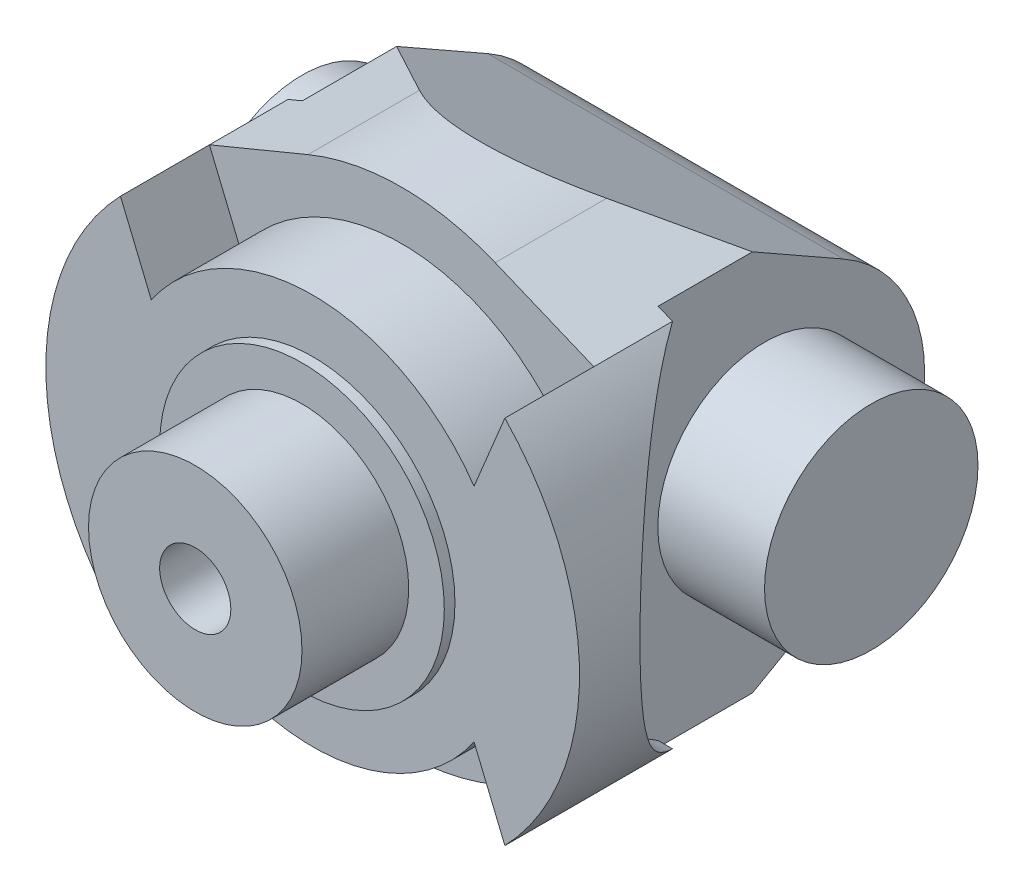
from build123d import *
from build123d.topology import SkipClean

# Parameters (mm, degrees)
SKETCH1_R                = 6
BOSS_EXTRUDE1_DEPTH      = 11
SKETCH2_R                = 6
BOSS_EXTRUDE2_DEPTH      = 8
CUT_EXTRUDE1_DEPTH       = 10
CUT_EXTRUDE1_DEPTH_BACK  = 3
SKETCH3_R                = 6
SKETCH3_R_2              = 3
SKETCH5_W                = 8.868099488
SKETCH5_H                = 25.092164851
CUT_EXTRUDE3_DEPTH       = 20.723082923
CUT_EXTRUDE2_START       = -3.3
CUT_EXTRUDE2_DEPTH       = 3.3
CUT_EXTRUDE5_DEPTH       = 2.5
BOSS_EXTRUDE3_REACH      = 18.961
BOSS_EXTRUDE3_END_RADIUS = 6
BOSS_EXTRUDE4_START      = -2.211146
BOSS_EXTRUDE4_DEPTH      = 2.211146
SKETCH10_R               = 3
CUT_EXTRUDE6_DEPTH       = 19.364367672
SKETCH12_R               = 4
SKETCH12_R_2             = 3
BOSS_EXTRUDE5_DEPTH      = 0.3
BOSS_EXTRUDE6_START      = -5
BOSS_EXTRUDE6_DEPTH      = 10
CUT_EXTRUDE12_DEPTH      = 19.364367672
CUT_EXTRUDE9_DEPTH       = 14.244940814
SKETCH15_OUTSIDE_W       = 23.236
SKETCH15_OUTSIDE_H       = 20.984
SKETCH15_OUTSIDE_W_2     = 17.302035992
SKETCH15_OUTSIDE_H_2     = 16.797371099
CUT_EXTRUDE10_DEPTH      = 19.748333259
SKETCH16_R               = 1
CUT_EXTRUDE11_DEPTH      = 19.748333259


with BuildPart() as part:
    # Sketch1 → Boss-Extrude1 (new body)
    with BuildSketch(Plane.XY):
        Circle(SKETCH1_R)
    extrude(amount=BOSS_EXTRUDE1_DEPTH)

    # Sketch2 → Boss-Extrude2 (add, symmetric)
    with BuildSketch(Plane(origin=(0, 0, 0), x_dir=(0, 0, -1), z_dir=(1, 0, 0))):
        Circle(SKETCH2_R)
    extrude(amount=BOSS_EXTRUDE2_DEPTH, both=True)

    # Sketch3 → Cut-Extrude1 (cut, two sides: drawn at the far end of the back side and taken through both)
    with BuildSketch(Plane.ZY.offset(8).offset(-CUT_EXTRUDE1_DEPTH_BACK)):
        with Locations(Location((0, 0, 0), (0, 0, 33.557309762))):
            Circle(SKETCH3_R)
        with Locations(Location((0, 0, 0), (0, 0, 180))):
            Circle(SKETCH3_R_2, mode=Mode.SUBTRACT)
    extrude(amount=CUT_EXTRUDE1_DEPTH + CUT_EXTRUDE1_DEPTH_BACK, mode=Mode.SUBTRACT)

    # Sketch5 → Cut-Extrude3 (cut, through all)
    with BuildSketch(Plane.XY.offset(11)):
        with Locations((4.434049744, 3.885168382)):
            Rectangle(SKETCH5_W, SKETCH5_H)
    extrude(amount=-CUT_EXTRUDE3_DEPTH, mode=Mode.SUBTRACT)

    # Sketch4 → Cut-Extrude2 (cut)
    with BuildSketch(Plane.XY.offset(11).offset(CUT_EXTRUDE2_START)):
        with BuildLine():
            Line((0, 3), (0, 6))
            ThreePointArc((0, 6), (-6, 0), (0, -6))
            Line((0, -6), (0, -3))
            ThreePointArc((0, -3), (-3, 0), (0, 3))
        make_face()
    extrude(amount=CUT_EXTRUDE2_DEPTH, mode=Mode.SUBTRACT)

    # Mirror1: part across plane


with BuildPart() as part_1:
    with SkipClean():  # the faces are left unmerged after this step: merging them gives an invalid solid
        add(part.part)
        add(part.part.mirror(Plane(origin=(0, -8.660914044, -6), x_dir=(0, 0, 1), z_dir=(-1, 0, 0))))

    # Sketch7 → Cut-Extrude5 (cut)
    with BuildSketch(Plane.XY.offset(7.7)):
        with BuildLine():
            Line((-4.535722056, 3.110823914), (-5.732457975, 6))
            Line((-5.732457975, 6), (5.732457975, 6))
            Line((5.732457975, 6), (4.535722056, 3.110823914))
            ThreePointArc((4.535722056, 3.110823914), (0, 5.5), (-4.535722056, 3.110823914))
        make_face()
        with BuildLine():
            Line((4.535722056, -3.110823914), (5.732457975, -6))
            Line((5.732457975, -6), (-5.732457975, -6))
            Line((-5.732457975, -6), (-4.535722056, -3.110823914))
            ThreePointArc((-4.535722056, -3.110823914), (0, -5.5), (4.535722056, -3.110823914))
        make_face()
    extrude(amount=-CUT_EXTRUDE5_DEPTH, mode=Mode.SUBTRACT)

    # Boss-Extrude3: up to this cylinder (the profile starts outside it)
    with SkipClean():  # the faces are left unmerged after this step: merging them gives an invalid solid
        boss_extrude3_end = Plane(origin=(0, 0, 0), z_dir=(1, 0, 0)) * Cylinder(BOSS_EXTRUDE3_END_RADIUS, 63.367438, mode=Mode.PRIVATE)
        # Sketch8 → Boss-Extrude3 (add, up to the surface)
        with BuildSketch(Plane.XY.offset(7.7), mode=Mode.PRIVATE) as boss_extrude3_sk1:
            with BuildLine():
                Line((4.760120042, 3.652568574), (5.402152292, 5.202571539))
                ThreePointArc((5.402152292, 5.202571539), (7.5, 0), (5.402152292, -5.202571539))
                Line((5.402152292, -5.202571539), (4.760120042, -3.652568574))
                ThreePointArc((4.760120042, -3.652568574), (6, 0), (4.760120042, 3.652568574))
            make_face()
        boss_extrude3_tool1 = extrude(boss_extrude3_sk1.sketch, amount=-BOSS_EXTRUDE3_REACH, mode=Mode.PRIVATE) - boss_extrude3_end
        add(boss_extrude3_tool1.solids().sort_by_distance((6.222719, 0, 7.7))[0])
        # Sketch8 → Boss-Extrude3 (add, up to the surface)
        with BuildSketch(Plane.XY.offset(7.7), mode=Mode.PRIVATE) as boss_extrude3_sk2:
            with BuildLine():
                Line((-4.760120042, 3.652568574), (-5.402152292, 5.202571539))
                ThreePointArc((-5.402152292, 5.202571539), (-7.5, 0), (-5.402152292, -5.202571539))
                Line((-5.402152292, -5.202571539), (-4.760120042, -3.652568574))
                ThreePointArc((-4.760120042, -3.652568574), (-6, 0), (-4.760120042, 3.652568574))
            make_face()
        boss_extrude3_tool2 = extrude(boss_extrude3_sk2.sketch, amount=-BOSS_EXTRUDE3_REACH, mode=Mode.PRIVATE) - boss_extrude3_end
        add(boss_extrude3_tool2.solids().sort_by_distance((-6.222719, 0, 7.7))[0])

    # Sketch9 → Boss-Extrude4 (add)
    with SkipClean():  # the faces are left unmerged after this step: merging them gives an invalid solid
        with BuildSketch(Plane.XY.offset(5.2).offset(BOSS_EXTRUDE4_START)):
            with BuildLine():
                Line((2.630513694, 6.350621836), (5.402152292, 5.202571539))
                Line((5.402152292, 5.202571539), (4.760120042, 3.652568574))
                ThreePointArc((4.760120042, 3.652568574), (0, 6), (-4.760120042, 3.652568574))
                Line((-4.760120042, 3.652568574), (-5.402152292, 5.202571539))
                Line((-5.402152292, 5.202571539), (-2.630513694, 6.350621836))
                ThreePointArc((-2.630513694, 6.350621836), (0, 6.873863542), (2.630513694, 6.350621836))
            make_face()
        extrude(amount=BOSS_EXTRUDE4_DEPTH)

    # Sketch10 → Cut-Extrude6 (cut, through all)
    with SkipClean():  # the faces are left unmerged after this step: merging them gives an invalid solid
        with BuildSketch(Plane.ZY.offset(5)):
            with BuildLine():
                ThreePointArc((2.988854192, 5.202571539), (-5.94680377, -0.79719817), (4.25356316, -4.231690023))
                ThreePointArc((4.25356316, -4.231690023), (5.94680377, 0.79719817), (2.988854192, 5.202571539))
            make_face()
            with Locations(Location((0, 0, 0), (0, 0, 180))):
                Circle(SKETCH10_R, mode=Mode.SUBTRACT)
        extrude(amount=CUT_EXTRUDE6_DEPTH, mode=Mode.SUBTRACT)

    # Mirror2: part across plane


with BuildPart() as part_2:
    add(part_1.part)
    add(part_1.part.mirror(Plane.ZX))

    # Sketch12 → Boss-Extrude5 (add)
    with BuildSketch(Plane.XY.offset(7.7)):
        Circle(SKETCH12_R)
        Circle(SKETCH12_R_2, mode=Mode.SUBTRACT)
    extrude(amount=BOSS_EXTRUDE5_DEPTH)

    # Sketch13 → Boss-Extrude6 (add)
    with BuildSketch(Plane(origin=(0, 0, 0), x_dir=(0, 0, -1), z_dir=(1, 0, 0)).offset(BOSS_EXTRUDE6_START)):
        with BuildLine():
            Line((-2.988854192, -6.873863542), (-2.988854192, -5.202571539))
            ThreePointArc((-2.988854192, -5.202571539), (-0.863689726, -5.937511268), (1.38278621, -5.838484589))
            Line((1.38278621, -5.838484589), (-2.988854192, -6.873863542))
        make_face()
        with BuildLine():
            Line((-2.988854192, 5.202571539), (-2.988854192, 6.873863542))
            Line((-2.988854192, 6.873863542), (1.38278621, 5.838484589))
            ThreePointArc((1.38278621, 5.838484589), (-0.863689726, 5.937511268), (-2.988854192, 5.202571539))
        make_face()
    extrude(amount=BOSS_EXTRUDE6_DEPTH)

    # Sketch17 → Cut-Extrude12 (cut, through all)
    with BuildSketch(Plane.ZY.offset(5)):
        with BuildLine():
            Line((2.988854192, -6.873863542), (-2.223044712, -3.912553157))
            ThreePointArc((-2.223044712, -3.912553157), (-4.5, 0), (-2.223044712, 3.912553157))
            Line((-2.223044712, 3.912553157), (2.988854192, 6.873863542))
            Line((2.988854192, 6.873863542), (-1.38278621, 5.838484589))
            ThreePointArc((-1.38278621, 5.838484589), (-6, 0), (-1.38278621, -5.838484589))
            Line((-1.38278621, -5.838484589), (2.988854192, -6.873863542))
        make_face()
    extrude(amount=-CUT_EXTRUDE12_DEPTH, mode=Mode.SUBTRACT)

    # Sketch14 → Cut-Extrude9 (cut, through all)
    with BuildSketch(Plane(origin=(0, 0, 2.988854192), x_dir=(-1, 0, 0), z_dir=(0, 0, -1))):
        with BuildLine():
            Line((5, -16.873863542), (-5, -16.873863542))
            Line((-5, -16.873863542), (-5, -5.369148472))
            Line((-5, -5.369148472), (-2.630513694, -6.350621836))
            ThreePointArc((-2.630513694, -6.350621836), (-1.341024252, -6.741784182), (0, -6.873863542))
            ThreePointArc((0, -6.873863542), (1.341024252, -6.741784182), (2.630513694, -6.350621836))
            Line((2.630513694, -6.350621836), (5, -5.369148472))
            Line((5, -5.369148472), (5, -16.873863542))
        make_face()
    extrude(amount=CUT_EXTRUDE9_DEPTH, mode=Mode.SUBTRACT)

    # Sketch15 outside → Cut-Extrude10 (cut, through all)
    with SkipClean():  # the faces are left unmerged after this step: merging them gives an invalid solid
        with BuildSketch(Plane.XY.offset(11)):
            Rectangle(SKETCH15_OUTSIDE_W, SKETCH15_OUTSIDE_H)
            with Locations((-8.651017996, -8.398685549)):
                Rectangle(SKETCH15_OUTSIDE_W_2, SKETCH15_OUTSIDE_H_2, mode=Mode.SUBTRACT)
        extrude(amount=-CUT_EXTRUDE10_DEPTH, mode=Mode.SUBTRACT)

    # Mirror3: part across plane


with BuildPart() as part_3:
    add(part_2.part)
    add(part_2.part.mirror(Plane(origin=(0, 0, -4.5), x_dir=(0, 0, 1), z_dir=(0, 1, 0))))

    # Mirror4: part across face


with BuildPart() as part_4:
    with SkipClean():  # the faces are left unmerged after this step: merging them gives an invalid solid
        add(part_3.part)
        add(part_3.part.mirror(Plane(origin=(0, 0, 3.307079487), x_dir=(0, 0, 1), z_dir=(1, 0, 0))))

    # Sketch16 → Cut-Extrude11 (cut, through all)
    with SkipClean():  # the faces are left unmerged after this step: merging them gives an invalid solid
        with BuildSketch(Plane.XY.offset(11)):
            Circle(SKETCH16_R)
        extrude(amount=-CUT_EXTRUDE11_DEPTH, mode=Mode.SUBTRACT)


solid = part_4.part
